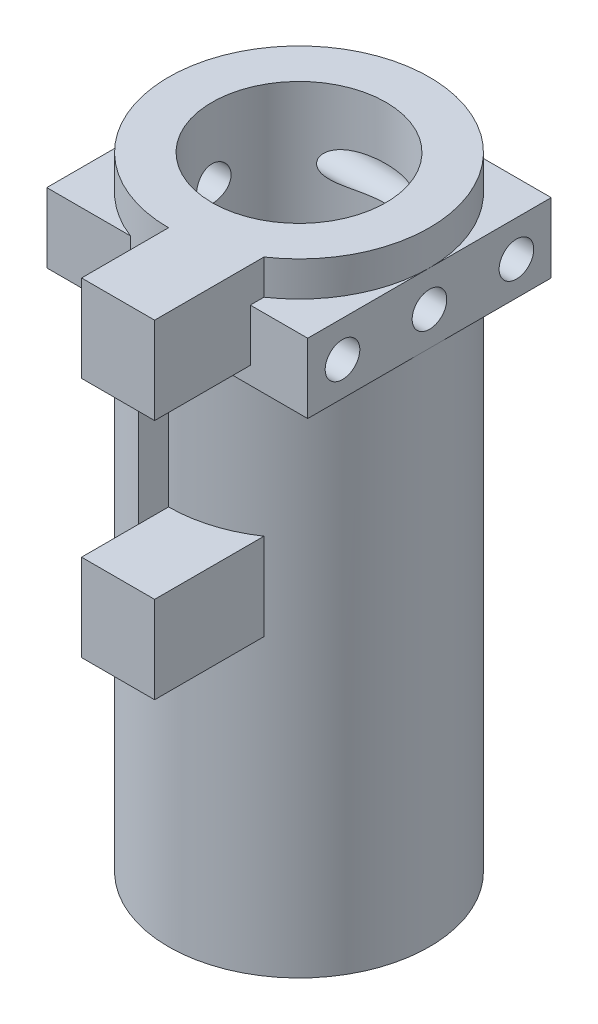
from build123d import *

# Parameters (mm, degrees)
SKETCH1_R                            = 19.05
SKETCH1_R_2                          = 12.7
BOSS_EXTRUDE1_DEPTH                  = 76.2
SKETCH2_W                            = 10.668
SKETCH2_H                            = 12.7
BOSS_EXTRUDE2_DEPTH                  = 12.7
BOSS_EXTRUDE2_DIRECTION_2_REACH      = 89.298
BOSS_EXTRUDE2_DIRECTION_2_END_RADIUS = 19.05
SKETCH3_R                            = 19.05
BOSS_EXTRUDE3_DEPTH                  = 2.032
SKETCH4_W                            = 5.08
SKETCH4_H                            = 35.306
CUT_EXTRUDE1_DEPTH                   = 87.551781172
BOSS_EXTRUDE4_REACH                  = 105.578
BOSS_EXTRUDE4_END_RADIUS             = 19.05
SKETCH7_W                            = 35.56
SKETCH7_H                            = 10.16
F_8_0_199_DIAMETER_HOLE1_D           = 5.0546


with BuildPart() as part:
    # Sketch1 → Boss-Extrude1 (new body)
    with BuildSketch(Plane(origin=(0, 0, 0), x_dir=(1, 0, 0), z_dir=(0, 1, 0))):
        with Locations(Location((0, 0, 0), (0, 0, 270))):
            Circle(SKETCH1_R)
        with Locations(Location((0, 0, 0), (0, 0, 270))):
            Circle(SKETCH1_R_2, mode=Mode.SUBTRACT)
    extrude(amount=-BOSS_EXTRUDE1_DEPTH)

    # Sketch2 → Boss-Extrude2 (add)
    with BuildSketch(Plane.XY.offset(19.05)):
        with Locations((5.334, -6.35)):
            Rectangle(SKETCH2_W, SKETCH2_H)
        with Locations((5.334, -41.656)):
            Rectangle(SKETCH2_W, SKETCH2_H)
    extrude(amount=BOSS_EXTRUDE2_DEPTH)

    # Boss-Extrude2 direction 2: up to this cylinder (the profile starts outside it)
    boss_extrude2_direction_2_end = Plane(origin=(0, -24.003, 0), z_dir=(0, 1, 0)) * Cylinder(BOSS_EXTRUDE2_DIRECTION_2_END_RADIUS, 253.002, mode=Mode.PRIVATE)
    # Sketch2 → Boss-Extrude2 direction 2 (add, up to the surface)
    with BuildSketch(Plane.XY.offset(19.05), mode=Mode.PRIVATE) as boss_extrude2_direction_2_sk1:
        with Locations((5.334, -6.35)):
            Rectangle(SKETCH2_W, SKETCH2_H)
    boss_extrude2_direction_2_tool1 = extrude(boss_extrude2_direction_2_sk1.sketch, amount=-BOSS_EXTRUDE2_DIRECTION_2_REACH, mode=Mode.PRIVATE) - boss_extrude2_direction_2_end
    add(boss_extrude2_direction_2_tool1.solids().sort_by_distance((5.334, -6.35, 19.05))[0])
    # Sketch2 → Boss-Extrude2 direction 2 (add, up to the surface)
    with BuildSketch(Plane.XY.offset(19.05), mode=Mode.PRIVATE) as boss_extrude2_direction_2_sk2:
        with Locations((5.334, -41.656)):
            Rectangle(SKETCH2_W, SKETCH2_H)
    boss_extrude2_direction_2_tool2 = extrude(boss_extrude2_direction_2_sk2.sketch, amount=-BOSS_EXTRUDE2_DIRECTION_2_REACH, mode=Mode.PRIVATE) - boss_extrude2_direction_2_end
    add(boss_extrude2_direction_2_tool2.solids().sort_by_distance((5.334, -41.656, 19.05))[0])

    # Sketch3 → Boss-Extrude3 (add)
    with BuildSketch(Plane.XZ.offset(76.2)):
        with Locations(Location((0, 0, 0), (0, 0, 90))):
            Circle(SKETCH3_R)
    extrude(amount=BOSS_EXTRUDE3_DEPTH)

    # Sketch4 → Cut-Extrude1 (cut, through all)
    with BuildSketch(Plane.XY):
        with Locations((-2.54, -24.003)):
            Rectangle(SKETCH4_W, SKETCH4_H)
    extrude(amount=CUT_EXTRUDE1_DEPTH, mode=Mode.SUBTRACT)

    # Sketch6 → Revolve2 (revolve)
    with BuildSketch(Plane.XY, mode=Mode.PRIVATE) as revolve2_sk:
        Polygon((-14.478, -78.232), (-16.51, -90.932), (-19.05, -90.932), (-19.05, -78.232), align=None)
    revolve(revolve2_sk.sketch.rotate(Axis((0, -78.232, 0), (0, -1, 0)), 270), axis=Axis((0, -78.232, 0), (0, -1, 0)))

    # Boss-Extrude4: up to this cylinder (the profile starts outside it)
    boss_extrude4_end = Plane(origin=(0, -10.16, 0), z_dir=(0, 1, 0)) * Cylinder(BOSS_EXTRUDE4_END_RADIUS, 250.256, mode=Mode.PRIVATE)
    # Sketch7 → Boss-Extrude4 (add, up to the surface)
    with BuildSketch(Plane.ZY.offset(19.05), mode=Mode.PRIVATE) as boss_extrude4_sk1:
        with Locations((0, -10.16)):
            Rectangle(SKETCH7_W, SKETCH7_H)
    boss_extrude4_tool1 = extrude(boss_extrude4_sk1.sketch, amount=-BOSS_EXTRUDE4_REACH, mode=Mode.PRIVATE) - boss_extrude4_end
    boss_extrude4 = boss_extrude4_tool1.solids().sort_by_distance((-19.05, -10.16, 0))[0] + boss_extrude4_tool1.solids().sort_by_distance((-19.05, -10.16, 0))[1]
    add(boss_extrude4)

    # Mirror1: Boss-Extrude4 across plane
    add(boss_extrude4.mirror(Plane(origin=(0, 0, 0), x_dir=(0, 0, 1), z_dir=(1, 0, 0))))

    # #8 (0.199) Diameter Hole1 (through all)
    with Locations(Plane.ZY.offset(19.05)):
        with Locations((0, -10.312752813), (12.7, -10.312752813), (-12.7, -10.312752813)):
            Hole(F_8_0_199_DIAMETER_HOLE1_D / 2)


solid = part.part
